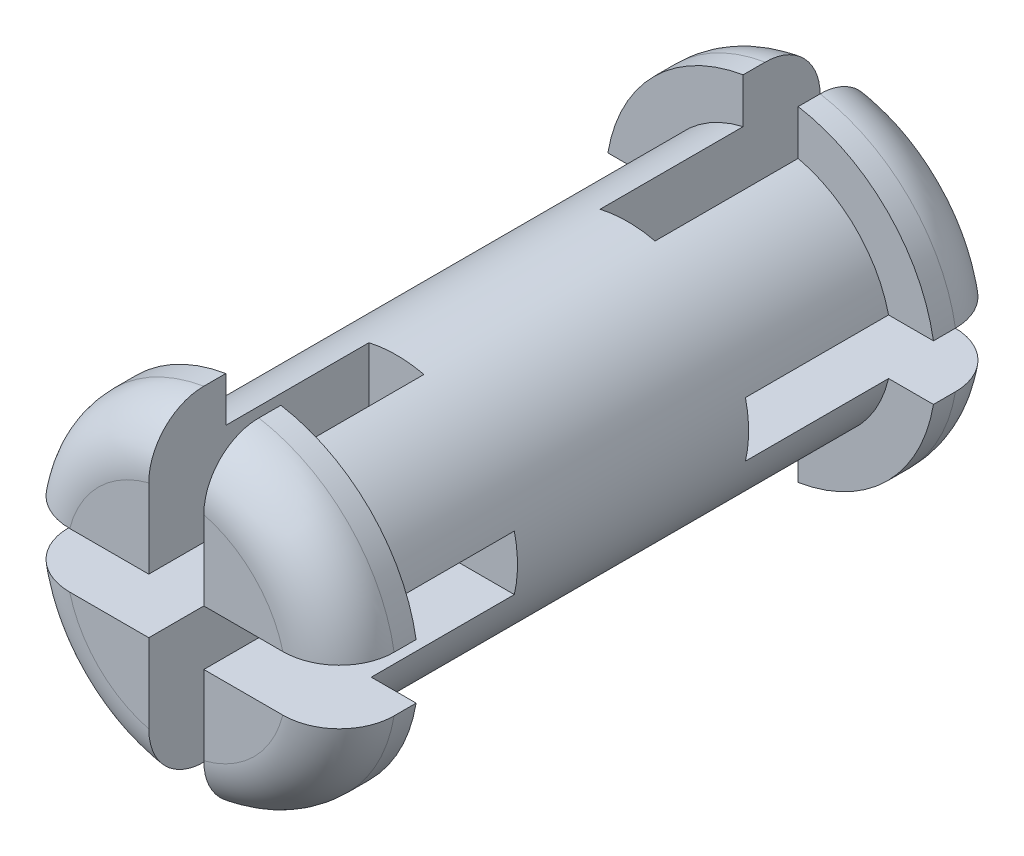
from build123d import *

# Parameters (mm, degrees)
SKETCH1_R           = 2.794
BOSS_EXTRUDE1_DEPTH = 7.747
CUT_EXTRUDE1_START  = -5.08
SKETCH2_W           = 1.27
SKETCH2_H           = 1.27
CUT_EXTRUDE1_DEPTH  = 5.08
BOSS_EXTRUDE2_START = -1.778
BOSS_EXTRUDE2_DEPTH = 1.778
FILLET1_R           = 1.27


with BuildPart() as part:
    # Sketch1 → Boss-Extrude1 (new body)
    with BuildSketch(Plane.XY):
        with Locations(Location((-0.391227277, -94.215792273, 0), (0, 0, 180))):
            Circle(SKETCH1_R)
    extrude(amount=BOSS_EXTRUDE1_DEPTH)

    # Sketch2 → Cut-Extrude1 (cut)
    with BuildSketch(Plane.XY.offset(7.747).offset(CUT_EXTRUDE1_START)):
        with BuildLine():
            ThreePointArc((2.402772723, -94.215792273), (2.384433594, -93.896194512), (2.329656954, -93.580792273))
            Line((2.329656954, -93.580792273), (0.243772723, -93.580792273))
            Line((0.243772723, -93.580792273), (0.243772723, -94.850792273))
            Line((0.243772723, -94.850792273), (2.329656954, -94.850792273))
            ThreePointArc((2.329656954, -94.850792273), (2.384433594, -94.535390034), (2.402772723, -94.215792273))
        make_face()
        with BuildLine():
            Line((-1.026227277, -94.850792273), (-1.026227277, -93.580792273))
            Line((-1.026227277, -93.580792273), (-3.112111508, -93.580792273))
            ThreePointArc((-3.112111508, -93.580792273), (-3.166888148, -93.896194512), (-3.185227277, -94.215792273))
            ThreePointArc((-3.185227277, -94.215792273), (-3.166888148, -94.535390034), (-3.112111508, -94.850792273))
            Line((-3.112111508, -94.850792273), (-1.026227277, -94.850792273))
        make_face()
        with BuildLine():
            Line((-1.026227277, -93.580792273), (0.243772723, -93.580792273))
            Line((0.243772723, -93.580792273), (0.243772723, -91.494908041))
            ThreePointArc((0.243772723, -91.494908041), (-0.071629516, -91.440131402), (-0.391227277, -91.421792273))
            ThreePointArc((-0.391227277, -91.421792273), (-0.710825038, -91.440131402), (-1.026227277, -91.494908041))
            Line((-1.026227277, -91.494908041), (-1.026227277, -93.580792273))
        make_face()
        with BuildLine():
            Line((0.243772723, -96.936676504), (0.243772723, -94.850792273))
            Line((0.243772723, -94.850792273), (-1.026227277, -94.850792273))
            Line((-1.026227277, -94.850792273), (-1.026227277, -96.936676504))
            ThreePointArc((-1.026227277, -96.936676504), (-0.71082509, -96.991453138), (-0.391227382, -97.009792273))
            ThreePointArc((-0.391227382, -97.009792273), (-0.071629568, -96.99145315), (0.243772723, -96.936676504))
        make_face()
        with Locations((-0.391227277, -94.215792273)):
            Rectangle(SKETCH2_W, SKETCH2_H)
    extrude(amount=CUT_EXTRUDE1_DEPTH, mode=Mode.SUBTRACT)

    # Sketch3 → Boss-Extrude2 (add)
    with BuildSketch(Plane.XY.offset(7.747).offset(BOSS_EXTRUDE2_START)):
        with BuildLine():
            Line((0.243772723, -96.936676504), (0.243772723, -97.972502935))
            ThreePointArc((0.243772723, -97.972502935), (2.302849559, -96.909869109), (3.365483385, -94.850792273))
            Line((3.365483385, -94.850792273), (2.329656954, -94.850792273))
            ThreePointArc((2.329656954, -94.850792273), (1.58442907, -96.191448619), (0.243772723, -96.936676504))
        make_face()
        with BuildLine():
            Line((-1.026227277, -97.972502935), (-1.026227277, -96.936676504))
            ThreePointArc((-1.026227277, -96.936676504), (-2.366883624, -96.191448619), (-3.112111508, -94.850792273))
            Line((-3.112111508, -94.850792273), (-4.147937939, -94.850792273))
            ThreePointArc((-4.147937939, -94.850792273), (-3.085304113, -96.909869109), (-1.026227277, -97.972502935))
        make_face()
        with BuildLine():
            Line((-4.147937939, -93.580792273), (-3.112111508, -93.580792273))
            ThreePointArc((-3.112111508, -93.580792273), (-2.366883624, -92.240135926), (-1.026227277, -91.494908041))
            Line((-1.026227277, -91.494908041), (-1.026227277, -90.45908161))
            ThreePointArc((-1.026227277, -90.45908161), (-3.085304113, -91.521715436), (-4.147937939, -93.580792273))
        make_face()
        with BuildLine():
            Line((0.243772723, -90.45908161), (0.243772723, -91.494908041))
            ThreePointArc((0.243772723, -91.494908041), (1.58442907, -92.240135926), (2.329656954, -93.580792273))
            Line((2.329656954, -93.580792273), (3.365483385, -93.580792273))
            ThreePointArc((3.365483385, -93.580792273), (2.302849559, -91.521715436), (0.243772723, -90.45908161))
        make_face()
    extrude(amount=BOSS_EXTRUDE2_DEPTH)

    # Fillet1
    fillet1_edges = [part.edges().sort_by_distance(p)[0] for p in [
        (2.302849559, -96.909869109, 7.747),
        (-3.085304113, -96.909869109, 7.747),
        (-3.085304113, -91.521715436, 7.747),
        (2.302849559, -91.521715436, 7.747),
    ]]
    fillet(fillet1_edges, radius=FILLET1_R)

    # Mirror2: part across plane


with BuildPart() as part_1:
    add(part.part)
    add(part.part.mirror(Plane(origin=(-0.391227277, -94.215792273, 0), x_dir=(1, 0, 0), z_dir=(0, 0, 1))))


solid = part_1.part
